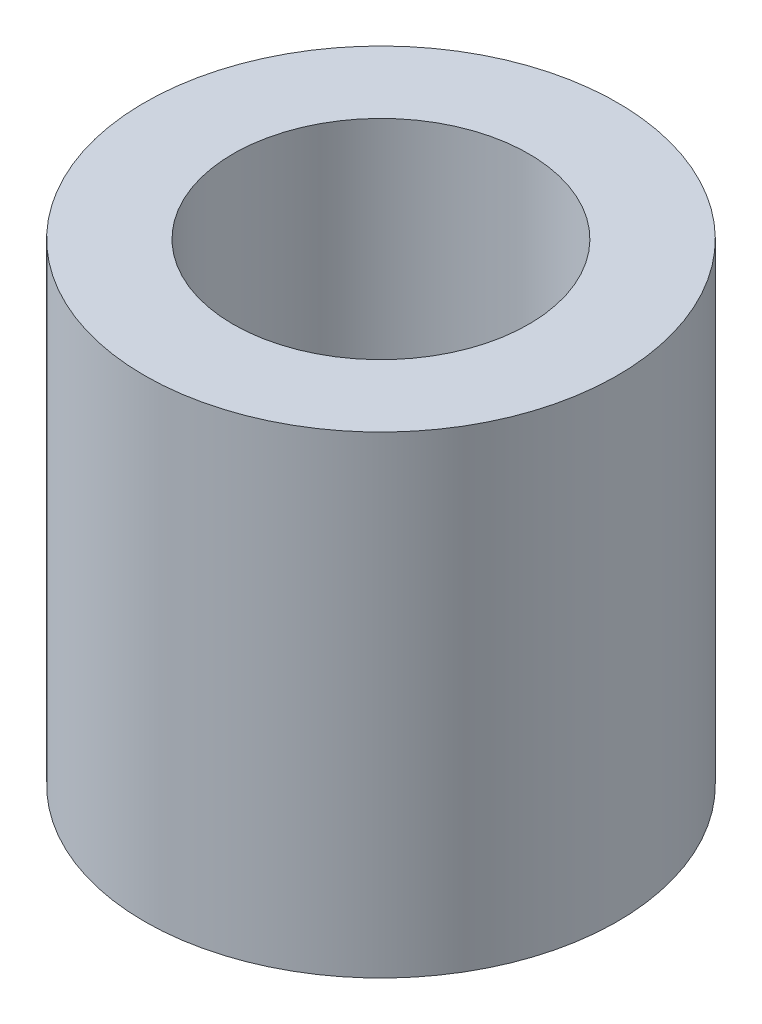
from build123d import *

# Parameters (mm, degrees)
SKETCH1_R           = 4
SKETCH1_R_2         = 2.5
BOSS_EXTRUDE1_DEPTH = 8


with BuildPart() as part:
    # Sketch1 → Boss-Extrude1 (new body)
    with BuildSketch(Plane(origin=(0, 0, 0), x_dir=(1, 0, 0), z_dir=(0, 1, 0))):
        with Locations(Location((0, 0, 0), (0, 0, 270))):
            Circle(SKETCH1_R)
        with Locations(Location((0, 0, 0), (0, 0, 270))):
            Circle(SKETCH1_R_2, mode=Mode.SUBTRACT)
    extrude(amount=BOSS_EXTRUDE1_DEPTH)


solid = part.part
